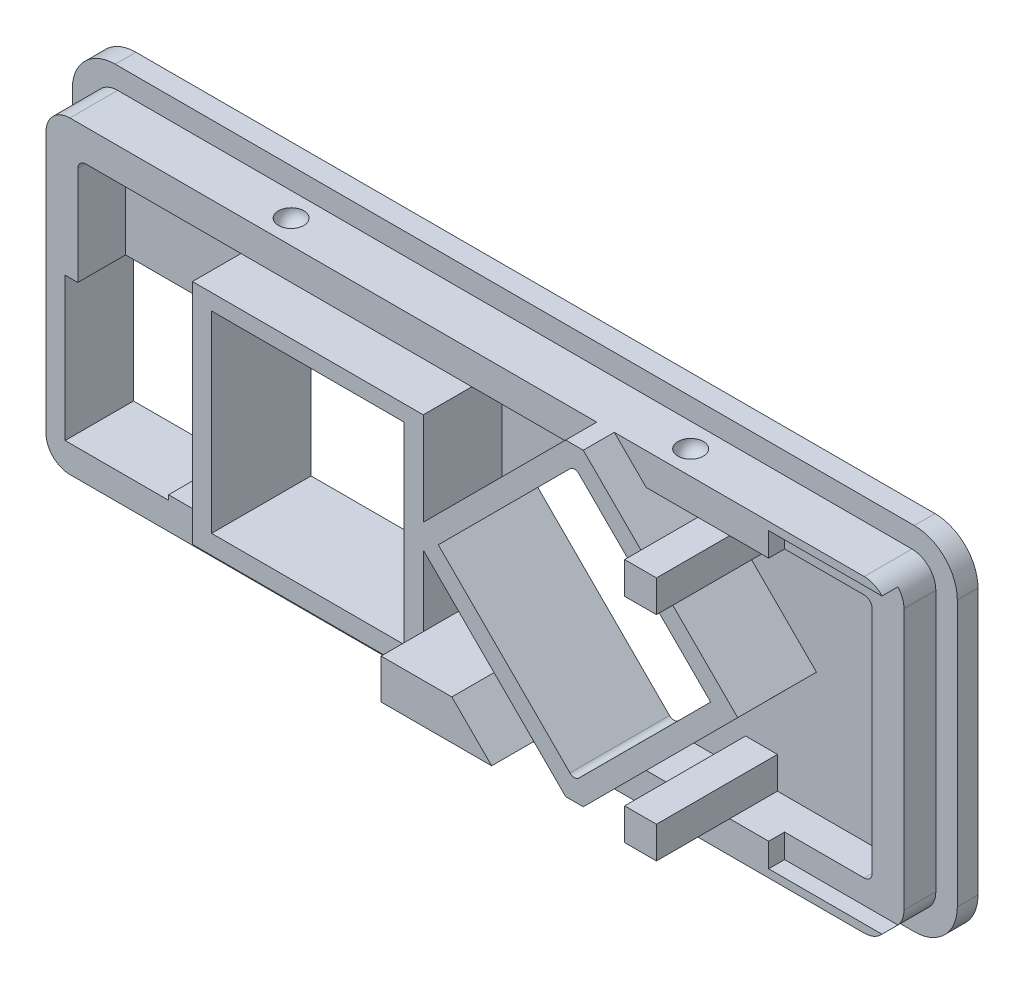
from build123d import *

# Parameters (mm, degrees)
BOSS_EXTRUDE1_DEPTH = 1.3
BOSS_EXTRUDE3_DEPTH = 3
CUT_EXTRUDE1_DEPTH  = 3
SKETCH11_W          = 6.5
SKETCH11_H          = 9
CUT_EXTRUDE2_DEPTH  = 4.3
SKETCH12_W          = 12.1
SKETCH12_H          = 12.1
CUT_EXTRUDE4_DEPTH  = 1.3
SKETCH17_W          = 14.5
SKETCH17_H          = 14.3
SKETCH17_W_2        = 12.1
SKETCH17_H_2        = 12.1
BOSS_EXTRUDE4_DEPTH = 6.25
CUT_EXTRUDE5_DEPTH  = 4.3
BOSS_EXTRUDE5_DEPTH = 6.25
CUT_EXTRUDE6_START  = -3
CUT_EXTRUDE6_DEPTH  = 23
SKETCH21_W          = 2.5
SKETCH21_H          = 2.5
CUT_EXTRUDE7_DEPTH  = 10
BOSS_EXTRUDE7_DEPTH = 7.6
SKETCH25_W          = 2
SKETCH25_H          = 2
BOSS_EXTRUDE8_DEPTH = 7.6
SKETCH27_W          = 1
SKETCH27_H          = 18.4
CUT_EXTRUDE8_DEPTH  = 7.5
FILLET1_R           = 0.4


with BuildPart() as part:
    # Sketch1 → Boss-Extrude1 (new body)
    with BuildSketch(Plane.XY):
        with BuildLine():
            Line((2.7, 0), (52.9, 0))
            ThreePointArc((52.9, 0), (54.809188309, 0.790811691), (55.6, 2.7))
            Line((55.6, 2.7), (55.6, 19.4))
            ThreePointArc((55.6, 19.4), (54.809188309, 21.309188309), (52.9, 22.1))
            Line((52.9, 22.1), (2.7, 22.1))
            ThreePointArc((2.7, 22.1), (0.790811691, 21.309188309), (0, 19.4))
            Line((0, 19.4), (0, 2.7))
            ThreePointArc((0, 2.7), (0.790811691, 0.790811691), (2.7, 0))
        make_face()
    extrude(amount=BOSS_EXTRUDE1_DEPTH)

    # Sketch4 → Boss-Extrude3 (add)
    with BuildSketch(Plane.XY.offset(1.3)):
        with BuildLine():
            Line((54.25, 2.85), (54.25, 19.25))
            ThreePointArc((54.25, 19.25), (53.810660172, 20.310660172), (52.75, 20.75))
            Line((52.75, 20.75), (2.85, 20.75))
            ThreePointArc((2.85, 20.75), (1.789339828, 20.310660172), (1.35, 19.25))
            Line((1.35, 19.25), (1.35, 2.85))
            ThreePointArc((1.35, 2.85), (1.789339828, 1.789339828), (2.85, 1.35))
            Line((2.85, 1.35), (52.75, 1.35))
            ThreePointArc((52.75, 1.35), (53.810660172, 1.789339828), (54.25, 2.85))
        make_face()
    extrude(amount=BOSS_EXTRUDE3_DEPTH)

    # Sketch5 → Cut-Extrude1 (cut)
    with BuildSketch(Plane.XY.offset(4.3)):
        with BuildLine():
            Line((51.75, 18.75), (3.85, 18.75))
            ThreePointArc((3.85, 18.75), (3.496446609, 18.603553391), (3.35, 18.25))
            Line((3.35, 18.25), (3.35, 3.85))
            ThreePointArc((3.35, 3.85), (3.496446609, 3.496446609), (3.85, 3.35))
            Line((3.85, 3.35), (51.75, 3.35))
            ThreePointArc((51.75, 3.35), (52.103553391, 3.496446609), (52.25, 3.85))
            Line((52.25, 3.85), (52.25, 18.25))
            ThreePointArc((52.25, 18.25), (52.103553391, 18.603553391), (51.75, 18.75))
        make_face()
    extrude(amount=-CUT_EXTRUDE1_DEPTH, mode=Mode.SUBTRACT)

    # Sketch10 → Cut-Revolve1 (revolve, cut)
    with BuildSketch(Plane(origin=(0, 20.75, 0), x_dir=(1, 0, 0), z_dir=(0, 1, 0))):
        with BuildLine():
            Line((40.35, -2), (40.35, -3.6))
            ThreePointArc((40.35, -3.6), (39.55, -2.8), (40.35, -2))
        make_face()
    cut_revolve1 = revolve(axis=Axis((40.35, 20.75, 2), (0, 0, 1)), mode=Mode.SUBTRACT)

    # Mirror1: Cut-Revolve1 across plane
    add(cut_revolve1.mirror(Plane(origin=(0, 11.05, 0), x_dir=(0, 0, 1), z_dir=(0, -1, 0))), mode=Mode.SUBTRACT)

    # Sketch11 → Cut-Extrude2 (cut)
    with BuildSketch(Plane(origin=(0, 0, 0), x_dir=(-1, 0, 0), z_dir=(0, 0, -1))):
        with Locations((-5.8, 7.55)):
            Rectangle(SKETCH11_W, SKETCH11_H)
    extrude(amount=-CUT_EXTRUDE2_DEPTH, mode=Mode.SUBTRACT)

    # Sketch12 → Cut-Extrude4 (cut)
    with BuildSketch(Plane(origin=(0, 0, 0), x_dir=(-1, 0, 0), z_dir=(0, 0, -1))):
        with Locations((-19.75, 10.6)):
            Rectangle(SKETCH12_W, SKETCH12_H)
    extrude(amount=-CUT_EXTRUDE4_DEPTH, mode=Mode.SUBTRACT)

    # Sketch17 → Boss-Extrude4 (add)
    with BuildSketch(Plane(origin=(0, 0, 0), x_dir=(-1, 0, 0), z_dir=(0, 0, -1))):
        with Locations((-19.75, 10.5)):
            Rectangle(SKETCH17_W, SKETCH17_H)
        with Locations((-19.75, 10.6)):
            Rectangle(SKETCH17_W_2, SKETCH17_H_2, mode=Mode.SUBTRACT)
    extrude(amount=-BOSS_EXTRUDE4_DEPTH)

    # Sketch13 → Cut-Extrude5 (cut)
    with BuildSketch(Plane(origin=(0, 0, 0), x_dir=(-1, 0, 0), z_dir=(0, 0, -1))):
        Polygon((-45.055992052, 11.05), (-36.5, 2.494007948), (-27.944007948, 11.05), (-36.5, 19.605992052), align=None)
    extrude(amount=-CUT_EXTRUDE5_DEPTH, mode=Mode.SUBTRACT)

    # Sketch18 → Boss-Extrude5 (add)
    with BuildSketch(Plane(origin=(0, 0, 0), x_dir=(-1, 0, 0), z_dir=(0, 0, -1))):
        Polygon((-46.753048327, 11.05), (-36.5, 0.796951673), (-26.246951673, 11.05), (-36.5, 21.303048327), align=None)
        Polygon((-36.5, 19.605992052), (-45.055992052, 11.05), (-36.5, 2.494007948), (-27.944007948, 11.05), align=None, mode=Mode.SUBTRACT)
    extrude(amount=-BOSS_EXTRUDE5_DEPTH)

    # Sketch20 → Cut-Extrude6 (cut)
    with BuildSketch(Plane.XY.offset(4.3).offset(CUT_EXTRUDE6_START)):
        Polygon((35.946951673, 20.75), (37.053048327, 20.75), (36.5, 21.303048327), align=None)
    cut_extrude6 = extrude(amount=CUT_EXTRUDE6_DEPTH, mode=Mode.SUBTRACT)

    # Mirror2: Cut-Extrude6 across plane
    add(cut_extrude6.mirror(Plane(origin=(0, 11.05, 0), x_dir=(0, 0, 1), z_dir=(0, -1, 0))), mode=Mode.SUBTRACT)

    # Sketch21 → Cut-Extrude7 (cut)
    with BuildSketch(Plane(origin=(0, 0, 0), x_dir=(-1, 0, 0), z_dir=(0, 0, -1))):
        with Locations((-29, 17.1)):
            Rectangle(SKETCH21_W, SKETCH21_H)
    extrude(amount=-CUT_EXTRUDE7_DEPTH, mode=Mode.SUBTRACT)

    # Mirror3: Cut-Revolve1 across plane
    add(cut_revolve1.mirror(Plane.ZY.offset(-27.8)), mode=Mode.SUBTRACT)

    # Mirror3 copy 1 sketch → Mirror3 copy 1 (revolve, cut)
    with BuildSketch(Plane(origin=(55.6, 1.35, 0), x_dir=(-1, 0, 0), z_dir=(0, -1, 0))):
        with BuildLine():
            Line((40.35, -2), (40.35, -3.6))
            ThreePointArc((40.35, -3.6), (39.55, -2.8), (40.35, -2))
        make_face()
    revolve(axis=Axis((15.25, 1.35, 2), (0, 0, 1)), mode=Mode.SUBTRACT)

    # Sketch24 → Boss-Extrude7 (add)
    with BuildSketch(Plane.XY.offset(1.3)):
        Polygon((33.946951673, 3.35), (27, 3.35), (27, 5.85), (31.446951673, 5.85), align=None)
    extrude(amount=BOSS_EXTRUDE7_DEPTH)

    # Sketch25 → Boss-Extrude8 (add)
    with BuildSketch(Plane.XY.offset(1.3)):
        with Locations((43.3, 4.35)):
            Rectangle(SKETCH25_W, SKETCH25_H)
    boss_extrude8 = extrude(amount=BOSS_EXTRUDE8_DEPTH)

    # Mirror4: Boss-Extrude8 across plane
    add(boss_extrude8.mirror(Plane(origin=(0, 11.05, 0), x_dir=(0, 0, 1), z_dir=(0, -1, 0))))

    # Sketch27 → Cut-Extrude8 (cut)
    with BuildSketch(Plane(origin=(54.25, 0, 0), x_dir=(0, 0, -1), z_dir=(1, 0, 0))):
        with Locations((-3.8, 11.05)):
            Rectangle(SKETCH27_W, SKETCH27_H)
    extrude(amount=-CUT_EXTRUDE8_DEPTH, mode=Mode.SUBTRACT)

    # Fillet1
    fillet1_edges = [part.edges().sort_by_distance(p)[0] for p in [
        (36.5, 19.605992052, 3.125),
        (36.5, 2.494007948, 3.125),
    ]]
    fillet(fillet1_edges, radius=FILLET1_R)


solid = part.part
